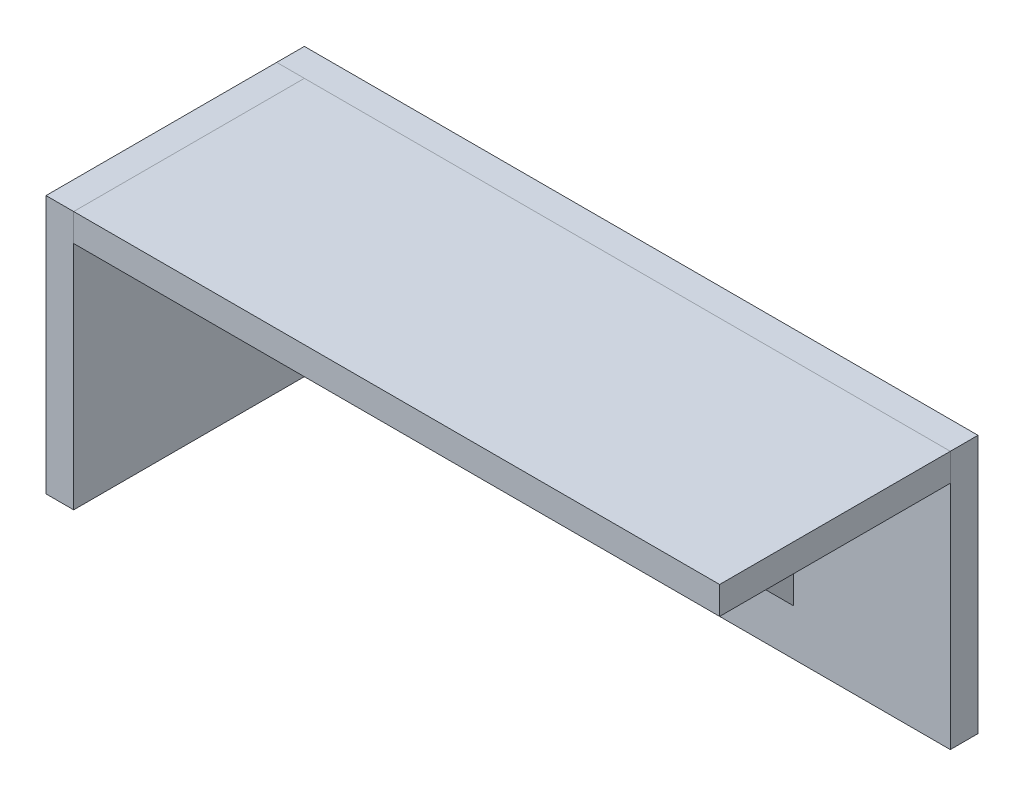
from build123d import *

# Parameters (mm, degrees)
SKETCH1_W           = 73
SKETCH1_H           = 28
BOSS_EXTRUDE1_DEPTH = 3
SKETCH3_W           = 70
SKETCH3_H           = 25
BOSS_EXTRUDE2_DEPTH = 3
BOSS_EXTRUDE3_START = 3
SKETCH4_W           = 25
SKETCH4_H           = 28
BOSS_EXTRUDE3_DEPTH = 3
BOSS_EXTRUDE4_START = 20
BOSS_EXTRUDE4_DEPTH = 3
BOSS_EXTRUDE5_START = 50
BOSS_EXTRUDE5_DEPTH = 3


with BuildPart() as part:
    # Sketch1 → Boss-Extrude1 (new body)
    with BuildSketch(Plane.XY):
        with Locations((-20, 2.5)):
            Rectangle(SKETCH1_W, SKETCH1_H)
    extrude(amount=-BOSS_EXTRUDE1_DEPTH)


with BuildPart() as body_2:
    # Sketch3 → Boss-Extrude2 (new body)
    with BuildSketch(Plane(origin=(0, 16.5, 0), x_dir=(1, 0, 0), z_dir=(0, 1, 0))):
        with Locations((-18.5, -12.5)):
            Rectangle(SKETCH3_W, SKETCH3_H)
    extrude(amount=-BOSS_EXTRUDE2_DEPTH)


with BuildPart() as body_3:
    # Sketch4 → Boss-Extrude3 (new body)
    with BuildSketch(Plane.ZY.offset(53.5).offset(BOSS_EXTRUDE3_START)):
        with Locations((12.5, 2.5)):
            Rectangle(SKETCH4_W, SKETCH4_H)
    extrude(amount=-BOSS_EXTRUDE3_DEPTH)


with BuildPart() as body_4:
    # Sketch5 → Boss-Extrude4 (new body)
    with BuildSketch(Plane(origin=(-53.5, 0, 0), x_dir=(0, 0, -1), z_dir=(1, 0, 0)).offset(BOSS_EXTRUDE4_START)):
        Polygon((-20, 13.5), (0, -6.5), (0, 13.5), align=None)
    extrude(amount=BOSS_EXTRUDE4_DEPTH)


with BuildPart() as body_5:
    # Sketch5<2> → Boss-Extrude5 (new body)
    with BuildSketch(Plane(origin=(-53.5, 0, 0), x_dir=(0, 0, -1), z_dir=(1, 0, 0)).offset(BOSS_EXTRUDE5_START)):
        Polygon((-20, 13.5), (0, -6.5), (0, 13.5), align=None)
    extrude(amount=BOSS_EXTRUDE5_DEPTH)


solid = Compound([part.part, body_2.part, body_3.part, body_4.part, body_5.part])
